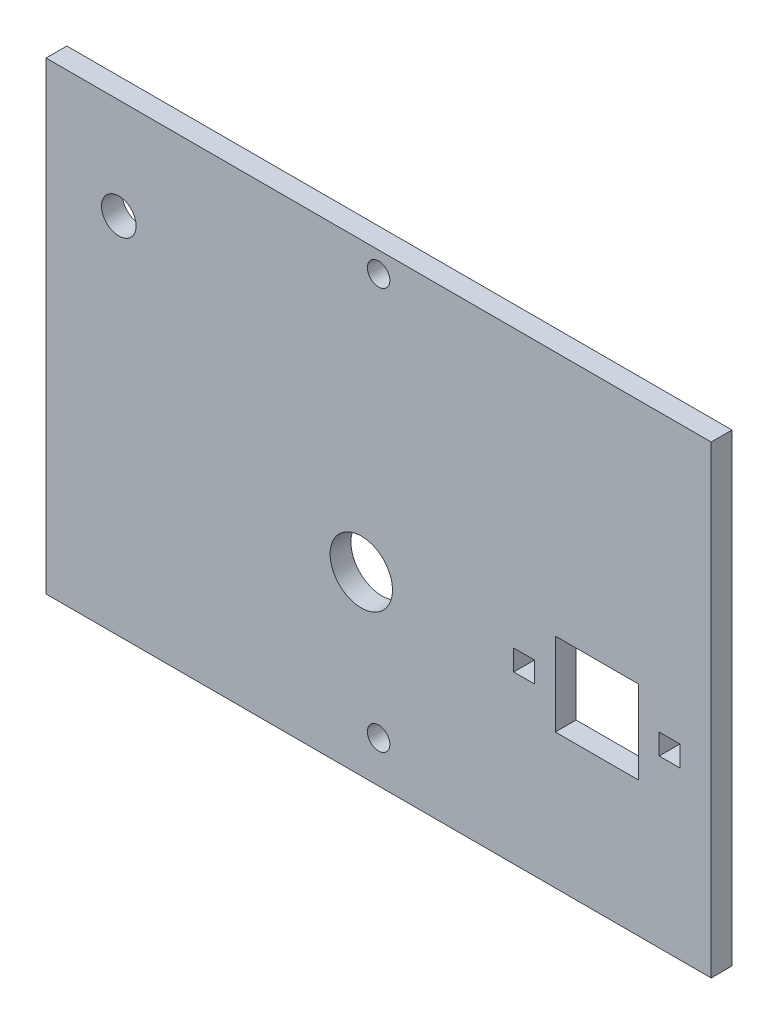
from build123d import *

# Parameters (mm, degrees)
CROQUIS1_W              = 96
CROQUIS1_H              = 67
SALIENTE_EXTRUIR1_DEPTH = 3
CROQUIS2_R              = 2.5
CROQUIS2_R_2            = 4.5
CROQUIS2_R_3            = 1.625
CROQUIS2_W              = 12
CROQUIS2_H              = 12
CROQUIS2_W_2            = 3
CROQUIS2_H_2            = 3
CORTAR_EXTRUIR1_DEPTH   = 59.611005792


with BuildPart() as part:
    # Croquis1 → Saliente-Extruir1 (new body)
    with BuildSketch(Plane.XY):
        Rectangle(CROQUIS1_W, CROQUIS1_H)
    extrude(amount=SALIENTE_EXTRUIR1_DEPTH)

    # Croquis2 → Cortar-Extruir1 (cut, through all)
    with BuildSketch(Plane.XY):
        with Locations((-37.5, 19)):
            Circle(CROQUIS2_R)
        with Locations((-2.5, -8)):
            Circle(CROQUIS2_R_2)
        with Locations((0, 30.5)):
            Circle(CROQUIS2_R_3)
        with Locations((0, -27.5)):
            Circle(CROQUIS2_R_3)
        with Locations((31.5, -8)):
            Rectangle(CROQUIS2_W, CROQUIS2_H)
        with Locations((21, -8)):
            Rectangle(CROQUIS2_W_2, CROQUIS2_H_2)
        with Locations((42, -8)):
            Rectangle(CROQUIS2_W_2, CROQUIS2_H_2)
    extrude(amount=CORTAR_EXTRUIR1_DEPTH, mode=Mode.SUBTRACT)


solid = part.part
